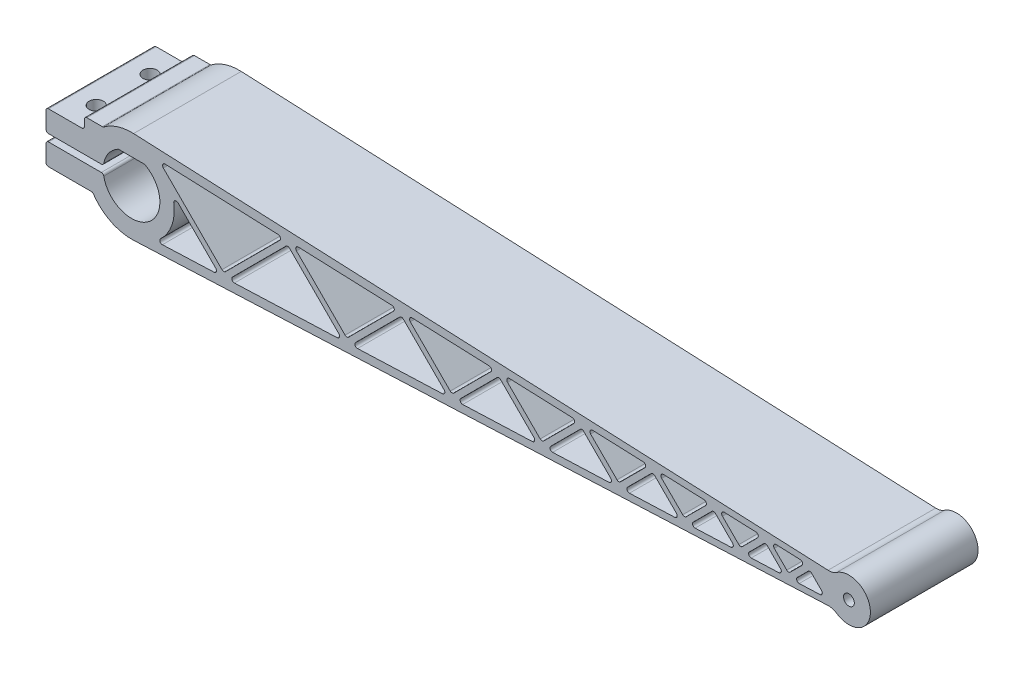
from build123d import *

# Parameters (mm, degrees)
SKETCH1_R           = 1
BOSS_EXTRUDE1_DEPTH = 15
SKETCH2_R           = 1
CUT_EXTRUDE1_DEPTH  = 105.560998943
FILLET1_R           = 0.35
SKETCH4_R           = 1
SKETCH4_R_2         = 0.75
BOSS_EXTRUDE2_DEPTH = 15


with BuildPart() as part:
    # Sketch1 → Boss-Extrude1 (new body)
    with BuildSketch(Plane.XY):
        with BuildLine():
            Line((-3.91822664, -0.5), (-11.924682731, -0.5))
            Line((-11.924682731, -0.5), (-11.924682731, -3.5))
            Line((-11.924682731, -3.5), (-5.417794754, -3.5))
            ThreePointArc((-5.417794754, -3.5), (-2.957602121, -5.731935947), (0.287025, -6.443610529))
            Line((0.287025, -6.443610529), (97.091971847, -2.131518769))
            ThreePointArc((97.091971847, -2.131518769), (97.728368045, -2.205906231), (98.308583108, -2.477722522))
            ThreePointArc((98.308583108, -2.477722522), (103, 0), (98.308583108, 2.477722522))
            ThreePointArc((98.308583108, 2.477722522), (97.728368045, 2.205906231), (97.091971847, 2.131518769))
            Line((97.091971847, 2.131518769), (0.287025, 6.443610529))
            ThreePointArc((0.287025, 6.443610529), (-1.950218056, 6.148101295), (-3.948733974, 5.1))
            Line((-3.948733974, 5.1), (-6.571238743, 5.1))
            Line((-6.571238743, 5.1), (-6.571238743, 3.5))
            Line((-6.571238743, 3.5), (-11.924682731, 3.5))
            Line((-11.924682731, 3.5), (-11.924682731, 0.5))
            Line((-11.924682731, 0.5), (-3.91822664, 0.5))
            ThreePointArc((-3.91822664, 0.5), (-3.242430239, 2.255913594), (-1.830983342, 3.5))
            Line((-1.830983342, 3.5), (1.830983342, 3.5))
            ThreePointArc((1.830983342, 3.5), (2.255913594, -3.242430239), (-3.91822664, -0.5))
        make_face()
        Polygon((88.963478068, 1.645749001), (94.011025285, 1.447599375), (91.58632649, -0.977099421), align=None, mode=Mode.SUBTRACT)
        with BuildLine():
            ThreePointArc((3.206155917, -5.012291316), (5.643134431, -1.88614257), (5.575683387, 2.077078421))
            Line((5.575683387, 2.077078421), (12.307755133, -4.654993325))
            Line((12.307755133, -4.654993325), (3.206155917, -5.012291316))
        make_face(mode=Mode.SUBTRACT)
        Polygon((29.468467153, -3.981321833), (13.440872209, -4.610510983), (21.769264256, 3.717881064), align=None, mode=Mode.SUBTRACT)
        Polygon((44.134225049, -3.405593798), (30.60158423, -3.93683949), (37.633527485, 3.095103765), align=None, mode=Mode.SUBTRACT)
        Polygon((56.667764123, -2.91356946), (45.267342125, -3.361111456), (51.191324122, 2.562870541), align=None, mode=Mode.SUBTRACT)
        Polygon((67.379082477, -2.493079343), (57.800881199, -2.869087118), (62.777985726, 2.108017409), align=None, mode=Mode.SUBTRACT)
        Polygon((76.533108343, -2.133723259), (68.512199553, -2.448597), (72.680090819, 1.719294266), align=None, mode=Mode.SUBTRACT)
        Polygon((84.356252684, -1.826613081), (77.666225419, -2.089240916), (81.142552969, 1.387086634), align=None, mode=Mode.SUBTRACT)
        Polygon((91.042009123, -1.564152904), (85.48936976, -1.782130738), (88.374678359, 1.10317786), align=None, mode=Mode.SUBTRACT)
        Polygon((96.755739716, -1.339851173), (92.175126199, -1.519670561), (94.555342652, 0.860545892), align=None, mode=Mode.SUBTRACT)
        with Locations((100, 0)):
            Circle(SKETCH1_R, mode=Mode.SUBTRACT)
        Polygon((21.224946889, 4.304934547), (12.8520725, -4.067939842), (3.794955626, 4.989177032), align=None, mode=Mode.SUBTRACT)
        Polygon((30.01278452, -3.39426835), (22.358063966, 4.260452205), (37.089210118, 3.682157248), align=None, mode=Mode.SUBTRACT)
        Polygon((44.678542416, -2.818540315), (38.222327195, 3.637674906), (50.647006755, 3.149924024), align=None, mode=Mode.SUBTRACT)
        Polygon((57.21208149, -2.326515977), (51.780123831, 3.105441681), (62.233668359, 2.695070892), align=None, mode=Mode.SUBTRACT)
        Polygon((67.923399844, -1.90602586), (63.366785435, 2.650588549), (72.135773452, 2.306347749), align=None, mode=Mode.SUBTRACT)
        Polygon((77.07742571, -1.546669776), (73.268890528, 2.261865406), (80.598235603, 1.974140117), align=None, mode=Mode.SUBTRACT)
        Polygon((84.900570051, -1.239559598), (81.731352679, 1.929657774), (87.830360992, 1.690231343), align=None, mode=Mode.SUBTRACT)
    extrude(amount=-BOSS_EXTRUDE1_DEPTH)

    # Sketch2 → Cut-Extrude1 (cut, through all)
    with BuildSketch(Plane(origin=(0, 3.5, 0), x_dir=(1, 0, 0), z_dir=(0, 1, 0))):
        with Locations(Location((-8.671238743, 11.25, 0), (0, 0, 270))):
            Circle(SKETCH2_R)
        with Locations(Location((-8.671238743, 3.75, 0), (0, 0, 270))):
            Circle(SKETCH2_R)
    extrude(amount=-CUT_EXTRUDE1_DEPTH, mode=Mode.SUBTRACT)

    # Fillet1
    fillet1_edges = [part.edges().sort_by_distance(p)[0] for p in [
        (92.175126199, -1.519670561, -7.5),
        (96.755739716, -1.339851173, -7.5),
        (94.555342652, 0.860545892, -7.5),
        (87.830360992, 1.690231343, -7.5),
        (81.731352679, 1.929657774, -7.5),
        (84.900570051, -1.239559598, -7.5),
        (88.963478068, 1.645749001, -7.5),
        (91.58632649, -0.977099421, -7.5),
        (94.011025285, 1.447599375, -7.5),
        (72.680090819, 1.719294266, -7.5),
        (68.512199553, -2.448597, -7.5),
        (76.533108343, -2.133723259, -7.5),
        (63.366785435, 2.650588549, -7.5),
        (67.923399844, -1.90602586, -7.5),
        (72.135773452, 2.306347749, -7.5),
        (57.800881199, -2.869087118, -7.5),
        (67.379082477, -2.493079343, -7.5),
        (62.777985726, 2.108017409, -7.5),
        (51.780123831, 3.105441681, -7.5),
        (57.21208149, -2.326515977, -7.5),
        (62.233668359, 2.695070892, -7.5),
        (45.267342125, -3.361111456, -7.5),
        (56.667764123, -2.91356946, -7.5),
        (51.191324122, 2.562870541, -7.5),
        (38.222327195, 3.637674906, -7.5),
        (44.678542416, -2.818540315, -7.5),
        (50.647006755, 3.149924024, -7.5),
        (30.60158423, -3.93683949, -7.5),
        (44.134225049, -3.405593798, -7.5),
        (37.633527485, 3.095103765, -7.5),
        (3.794955626, 4.989177032, -7.5),
        (12.8520725, -4.067939842, -7.5),
        (21.224946889, 4.304934547, -7.5),
        (13.440872209, -4.610510983, -7.5),
        (29.468467153, -3.981321833, -7.5),
        (21.769264256, 3.717881064, -7.5),
        (37.089210118, 3.682157248, -7.5),
        (22.358063966, 4.260452205, -7.5),
        (30.01278452, -3.39426835, -7.5),
        (73.268890528, 2.261865406, -7.5),
        (77.07742571, -1.546669776, -7.5),
        (80.598235603, 1.974140117, -7.5),
        (81.142552969, 1.387086634, -7.5),
        (77.666225419, -2.089240916, -7.5),
        (84.356252684, -1.826613081, -7.5),
        (91.042009123, -1.564152904, -7.5),
        (88.374678359, 1.10317786, -7.5),
        (85.48936976, -1.782130738, -7.5),
        (3.206155917, -5.012291316, -7.5),
        (12.307755133, -4.654993325, -7.5),
        (5.575683387, 2.077078421, -7.5),
        (-5.417794754, -3.5, -7.5),
        (-11.924682731, -3.5, -7.5),
        (-11.924682731, -0.5, -7.5),
        (-3.91822664, -0.5, -7.5),
        (1.830983342, 3.5, -7.5),
        (-1.830983342, 3.5, -7.5),
        (-3.91822664, 0.5, -7.5),
        (-11.924682731, 0.5, -7.5),
        (-11.924682731, 3.5, -7.5),
        (-6.571238743, 3.5, -7.5),
        (-6.571238743, 5.1, -7.5),
        (-3.948733974, 5.1, -7.5),
    ]]
    fillet(fillet1_edges, radius=FILLET1_R)

    # Sketch4 → Boss-Extrude2 (add)
    with BuildSketch(Plane.XY):
        with Locations((100, 0)):
            Circle(SKETCH4_R)
        with Locations((100, 0)):
            Circle(SKETCH4_R_2, mode=Mode.SUBTRACT)
    extrude(amount=-BOSS_EXTRUDE2_DEPTH)


solid = part.part
